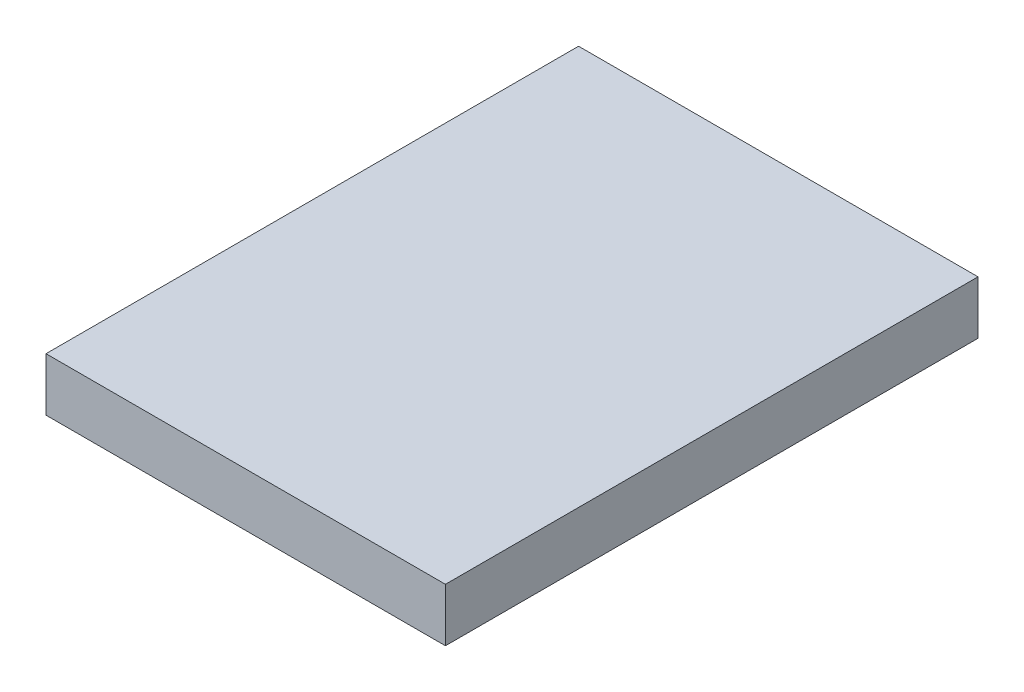
from build123d import *

# Parameters (mm, degrees)
SKETCH1_W           = 15000
SKETCH1_H           = 20000
BOSS_EXTRUDE1_DEPTH = 2000


with BuildPart() as part:
    # Sketch1 → Boss-Extrude1 (new body)
    with BuildSketch(Plane(origin=(0, 0, 0), x_dir=(1, 0, 0), z_dir=(0, 1, 0))):
        with Locations((7500, -10000)):
            Rectangle(SKETCH1_W, SKETCH1_H)
    extrude(amount=BOSS_EXTRUDE1_DEPTH)


solid = part.part
